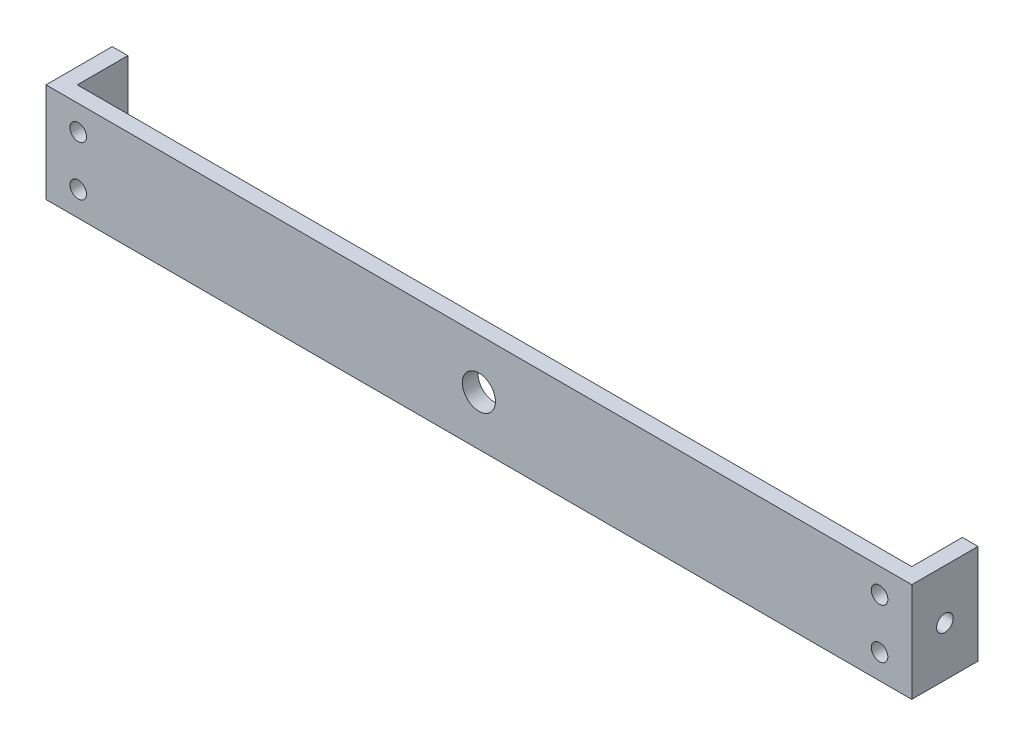
from build123d import *

# Parameters (mm, degrees)
CROQUIS1_W              = 320
CROQUIS1_H              = 38.1
CROQUIS1_R              = 6.35
SALIENTE_EXTRUIR1_DEPTH = 6
CROQUIS3_W              = 6
CROQUIS3_H              = 38.1
SALIENTE_EXTRUIR2_DEPTH = 25.4
CROQUIS4_R              = 3.175
CORTAR_EXTRUIR1_DEPTH   = 25.4
CROQUIS5_R              = 3.175
CORTAR_EXTRUIR2_DEPTH   = 348.712979417


with BuildPart() as part:
    # Croquis1 → Saliente-Extruir1 (new body)
    with BuildSketch(Plane.XY):
        Rectangle(CROQUIS1_W, CROQUIS1_H)
        Circle(CROQUIS1_R, mode=Mode.SUBTRACT)
    extrude(amount=SALIENTE_EXTRUIR1_DEPTH)

    # Croquis3 → Saliente-Extruir2 (add)
    with BuildSketch(Plane.XY.offset(6)):
        with Locations((163, 0)):
            Rectangle(CROQUIS3_W, CROQUIS3_H)
        with Locations((-163, 0)):
            Rectangle(CROQUIS3_W, CROQUIS3_H)
    extrude(amount=-SALIENTE_EXTRUIR2_DEPTH)

    # Croquis4 → Cortar-Extruir1 (cut)
    with BuildSketch(Plane(origin=(0, 0, 0), x_dir=(-1, 0, 0), z_dir=(0, 0, -1))):
        with Locations((153.65, 9.525)):
            Circle(CROQUIS4_R)
        with Locations((153.65, -9.525)):
            Circle(CROQUIS4_R)
        with Locations(Location((-153.65, -9.525, 0), (0, 0, 180))):
            Circle(CROQUIS4_R)
        with Locations(Location((-153.65, 9.525, 0), (0, 0, 180))):
            Circle(CROQUIS4_R)
    extrude(amount=-CORTAR_EXTRUIR1_DEPTH, mode=Mode.SUBTRACT)

    # Croquis5 → Cortar-Extruir2 (cut)
    with BuildSketch(Plane(origin=(166, 0, 0), x_dir=(0, 0, -1), z_dir=(1, 0, 0))):
        with Locations((6.7, 0)):
            Circle(CROQUIS5_R)
    extrude(amount=-CORTAR_EXTRUIR2_DEPTH, mode=Mode.SUBTRACT)


solid = part.part
